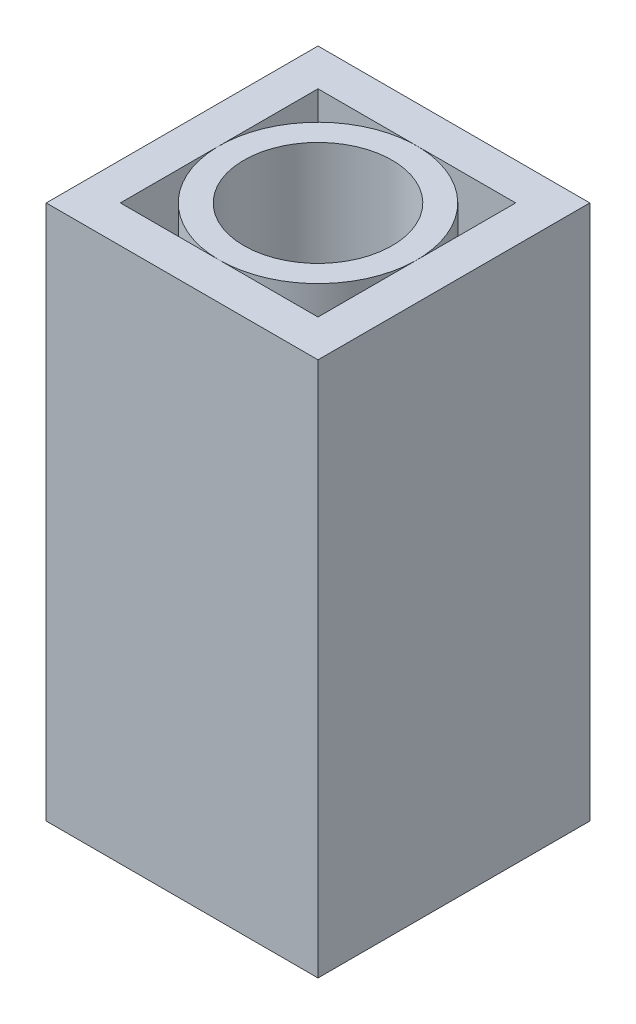
from build123d import *

# Parameters (mm, degrees)
SKETCH_1_R        = 9
EXTRUDE_1_DEPTH   = 65
SKETCH_1_W        = 33
SKETCH_1_H        = 33
EXTRUDE_1_2_DEPTH = 65
SKETCH_1_3_R      = 9
EXTRUDE_2_DEPTH   = 30


with BuildPart() as part:
    # 草图1 → 凸台-拉伸1 (new body)
    with BuildSketch(Plane(origin=(0, 0, 0), x_dir=(1, 0, 0), z_dir=(0, 1, 0))):
        with BuildLine():
            ThreePointArc((12, 0), (8.485281374, 8.485281374), (0, 12))
            ThreePointArc((0, 12), (-8.485281374, 8.485281374), (-12, 0))
            ThreePointArc((-12, 0), (-8.485281374, -8.485281374), (0, -12))
            ThreePointArc((0, -12), (8.485281374, -8.485281374), (12, 0))
        make_face()
        Circle(SKETCH_1_R, mode=Mode.SUBTRACT)
    extrude(amount=EXTRUDE_1_DEPTH)

    # 草图1<3> → 凸台-拉伸2 (add)
    with BuildSketch(Plane(origin=(0, 0, 0), x_dir=(1, 0, 0), z_dir=(0, 1, 0))):
        Circle(SKETCH_1_3_R)
    extrude(amount=EXTRUDE_2_DEPTH)


with BuildPart() as body_2:
    # 草图1 → Extrude 1 2 (new body)
    with BuildSketch(Plane(origin=(0, 0, 0), x_dir=(1, 0, 0), z_dir=(0, 1, 0))):
        Rectangle(SKETCH_1_W, SKETCH_1_H)
        Polygon((-12, 12), (0, 12), (12, 12), (12, 0), (12, -12), (0, -12), (-12, -12), (-12, 0), align=None, mode=Mode.SUBTRACT)
    extrude(amount=EXTRUDE_1_2_DEPTH)


solid = Compound([part.part, body_2.part])
